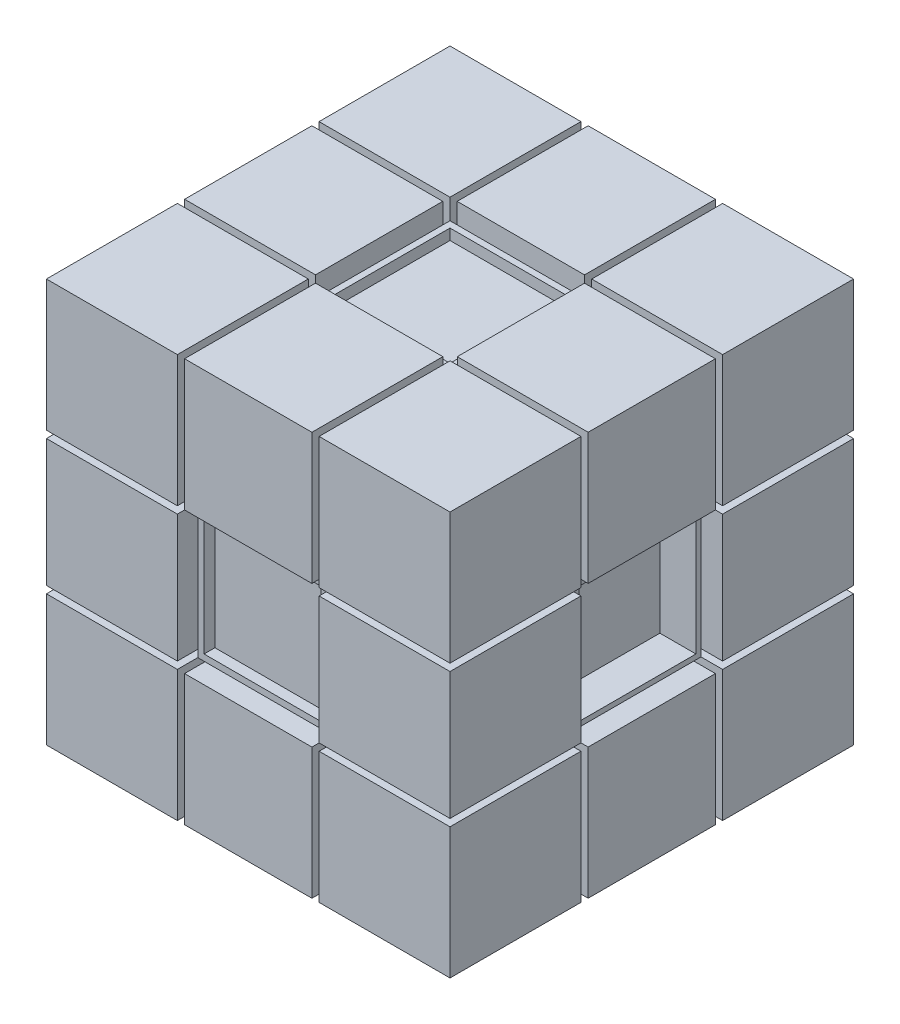
from build123d import *

# Parameters (mm, degrees)
SKETCH1_W           = 56
SKETCH1_H           = 56
BOSS_EXTRUDE1_DEPTH = 28
SKETCH2_W           = 16.25
SKETCH2_H           = 16.25
CUT_EXTRUDE1_DEPTH  = 3.5
SKETCH2_3_W         = 18
SKETCH2_3_H         = 18
SKETCH2_3_W_2       = 16.25
SKETCH2_3_H_2       = 16.25
CUT_EXTRUDE6_DEPTH  = 2
SKETCH6_W           = 18
SKETCH6_H           = 18
CUT_EXTRUDE2_DEPTH  = 18.67
CIRPATTERN6_COUNT   = 4
SKETCH12_W          = 18
SKETCH12_H          = 18
SKETCH12_W_2        = 16.25
SKETCH12_H_2        = 16.25
CUT_EXTRUDE7_DEPTH  = 2
SKETCH12_3_W        = 16.25
SKETCH12_3_H        = 16.25
CUT_EXTRUDE8_DEPTH  = 7
SKETCH13_W          = 19.66
SKETCH13_H          = 19.66
SKETCH13_W_2        = 17.66
SKETCH13_H_2        = 17.66
CUT_EXTRUDE9_DEPTH  = 18.67
SKETCH14_W          = 18
SKETCH14_H          = 18
SKETCH14_W_2        = 16.25
SKETCH14_H_2        = 16.25
CUT_EXTRUDE10_DEPTH = 2
SKETCH14_2_W        = 16.25
SKETCH14_2_H        = 16.25
CUT_EXTRUDE11_DEPTH = 7
SKETCH15_W          = 19.66
SKETCH15_H          = 19.66
SKETCH15_W_2        = 17.66
SKETCH15_H_2        = 17.66
CUT_EXTRUDE12_DEPTH = 18.67


with BuildPart() as part:
    # Sketch1 → Boss-Extrude1 (new, symmetric)
    with BuildSketch(Plane(origin=(0, 0, 0), x_dir=(1, 0, 0), z_dir=(0, 1, 0))):
        Rectangle(SKETCH1_W, SKETCH1_H)
    extrude(amount=BOSS_EXTRUDE1_DEPTH, both=True)

    # Sketch2 → Cut-Extrude1 (cut, symmetric)
    with BuildSketch(Plane(origin=(0, 28, 0), x_dir=(1, 0, 0), z_dir=(0, 1, 0))):
        Rectangle(SKETCH2_W, SKETCH2_H)
    cut_extrude1 = extrude(amount=CUT_EXTRUDE1_DEPTH, both=True, mode=Mode.SUBTRACT)

    # Sketch2<3> → Cut-Extrude6 (cut)
    with BuildSketch(Plane(origin=(0, 28, 0), x_dir=(1, 0, 0), z_dir=(0, 1, 0))):
        Rectangle(SKETCH2_3_W, SKETCH2_3_H)
        Rectangle(SKETCH2_3_W_2, SKETCH2_3_H_2, mode=Mode.SUBTRACT)
    cut_extrude6 = extrude(amount=-CUT_EXTRUDE6_DEPTH, mode=Mode.SUBTRACT)

    # Sketch6 → Cut-Extrude2 (cut)
    with BuildSketch(Plane(origin=(0, 28, 0), x_dir=(1, 0, 0), z_dir=(0, 1, 0))):
        Polygon((-8.833333333, 28), (-9.833333333, 28), (-9.833333333, 9.83), (-28, 9.83), (-28, 8.83), (-9.833333333, 8.83), (-9.833333333, -8.83), (-28, -8.83), (-28, -9.83), (-9.833333333, -9.83), (-9.833333333, -28), (-8.833333333, -28), (-8.833333333, -9.83), (8.836666667, -9.83), (8.836666667, -28), (9.836666667, -28), (9.836666667, -9.83), (28, -9.83), (28, -8.83), (9.836666667, -8.83), (9.836666667, 8.83), (28, 8.83), (28, 9.83), (9.836666667, 9.83), (9.836666667, 28), (8.836666667, 28), (8.836666667, 9.83), (-8.833333333, 9.83), align=None)
        Rectangle(SKETCH6_W, SKETCH6_H, mode=Mode.SUBTRACT)
    cut_extrude2 = extrude(amount=-CUT_EXTRUDE2_DEPTH, mode=Mode.SUBTRACT)

    # CirPattern6: Cut-Extrude1, Cut-Extrude6, Cut-Extrude2 ×4 about axis
    cirpattern6_axis = Axis((0, 0, 0), (1, 0, 0))
    add([cut_extrude1.rotate(cirpattern6_axis, i * 360 / CIRPATTERN6_COUNT) for i in range(1, CIRPATTERN6_COUNT)], mode=Mode.SUBTRACT)
    add([cut_extrude6.rotate(cirpattern6_axis, i * 360 / CIRPATTERN6_COUNT) for i in range(1, CIRPATTERN6_COUNT)], mode=Mode.SUBTRACT)
    add([cut_extrude2.rotate(cirpattern6_axis, i * 360 / CIRPATTERN6_COUNT) for i in range(1, CIRPATTERN6_COUNT)], mode=Mode.SUBTRACT)

    # Sketch12 → Cut-Extrude7 (cut)
    with BuildSketch(Plane.ZY.offset(28)):
        Rectangle(SKETCH12_W, SKETCH12_H)
        Rectangle(SKETCH12_W_2, SKETCH12_H_2, mode=Mode.SUBTRACT)
    extrude(amount=-CUT_EXTRUDE7_DEPTH, mode=Mode.SUBTRACT)

    # Sketch12<3> → Cut-Extrude8 (cut)
    with BuildSketch(Plane.ZY.offset(28)):
        Rectangle(SKETCH12_3_W, SKETCH12_3_H)
    extrude(amount=-CUT_EXTRUDE8_DEPTH, mode=Mode.SUBTRACT)

    # Sketch13 → Cut-Extrude9 (cut)
    with BuildSketch(Plane.ZY.offset(28)):
        Rectangle(SKETCH13_W, SKETCH13_H)
        Rectangle(SKETCH13_W_2, SKETCH13_H_2, mode=Mode.SUBTRACT)
    extrude(amount=-CUT_EXTRUDE9_DEPTH, mode=Mode.SUBTRACT)

    # Sketch14 → Cut-Extrude10 (cut)
    with BuildSketch(Plane(origin=(28, 0, 0), x_dir=(0, 0, -1), z_dir=(1, 0, 0))):
        Rectangle(SKETCH14_W, SKETCH14_H)
        Rectangle(SKETCH14_W_2, SKETCH14_H_2, mode=Mode.SUBTRACT)
    extrude(amount=-CUT_EXTRUDE10_DEPTH, mode=Mode.SUBTRACT)

    # Sketch14<2> → Cut-Extrude11 (cut)
    with BuildSketch(Plane(origin=(28, 0, 0), x_dir=(0, 0, -1), z_dir=(1, 0, 0))):
        Rectangle(SKETCH14_2_W, SKETCH14_2_H)
    extrude(amount=-CUT_EXTRUDE11_DEPTH, mode=Mode.SUBTRACT)

    # Sketch15 → Cut-Extrude12 (cut)
    with BuildSketch(Plane(origin=(28, 0, 0), x_dir=(0, 0, -1), z_dir=(1, 0, 0))):
        Rectangle(SKETCH15_W, SKETCH15_H)
        Rectangle(SKETCH15_W_2, SKETCH15_H_2, mode=Mode.SUBTRACT)
    extrude(amount=-CUT_EXTRUDE12_DEPTH, mode=Mode.SUBTRACT)


solid = part.part
